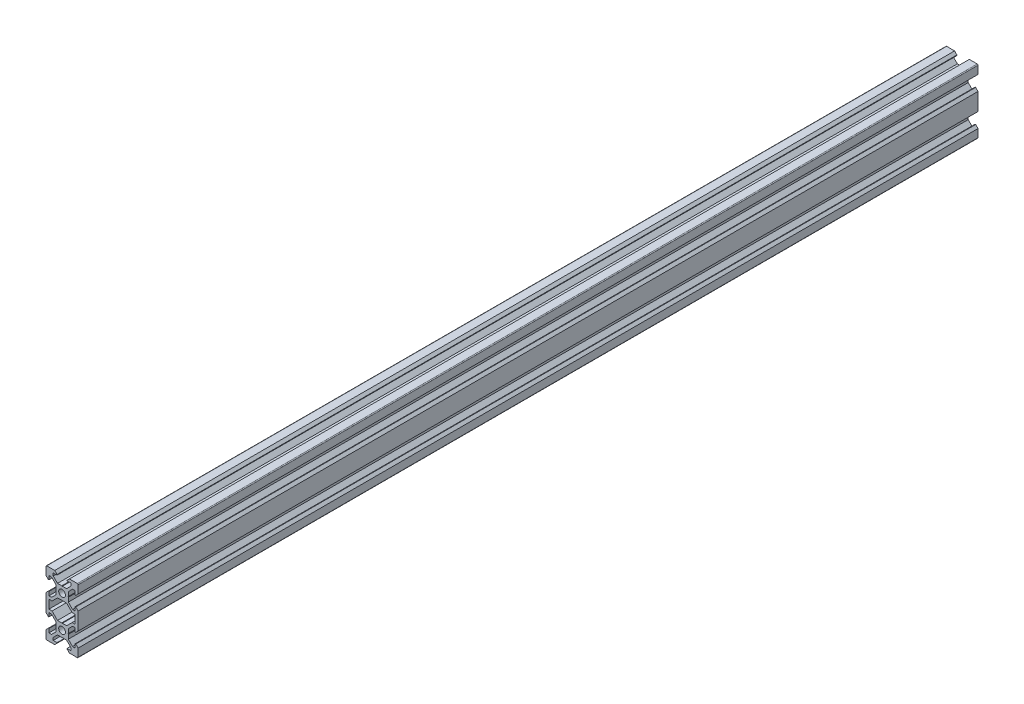
from build123d import *
from build123d.topology import SkipClean

# Parameters (mm, degrees)
BOSS_EXTRU_1_DEPTH     = 560.3
SYM_TRIE6_COPY_1_DEPTH = 560.3


with BuildPart() as part:
    # Esquisse1 → Boss.-Extru.1 (new body)
    with BuildSketch(Plane.XY):
        with BuildLine():
            Line((-9.5, 10), (-4.58, 10))
            Line((-4.58, 10), (-3.125, 8.545))
            Line((-3.125, 8.545), (-3.125, 8.2))
            Line((-3.125, 8.2), (-5.5, 8.2))
            Line((-5.5, 8.2), (-5.5, 6.560660172))
            Line((-5.5, 6.560660172), (-2.839339828, 3.9))
            Line((-2.839339828, 3.9), (-0.21, 3.9))
            Line((-0.21, 3.9), (0, 3.69))
            Line((0, 3.69), (0, 2.1))
            ThreePointArc((0, 2.1), (-2.1, 0), (0, -2.1))
            Line((0, -2.1), (0, -3.69))
            Line((0, -3.69), (-0.21, -3.9))
            Line((-0.21, -3.9), (-2.839339828, -3.9))
            Line((-2.839339828, -3.9), (-6.239339828, -7.3))
            Line((-6.239339828, -7.3), (-8.2, -7.3))
            Line((-8.2, -7.3), (-8.2, -10))
            Line((-8.2, -10), (-10, -10))
            Line((-10, -10), (-10, -4.58))
            Line((-10, -4.58), (-8.545, -3.125))
            Line((-8.545, -3.125), (-8.2, -3.125))
            Line((-8.2, -3.125), (-8.2, -5.5))
            Line((-8.2, -5.5), (-6.560660172, -5.5))
            Line((-6.560660172, -5.5), (-3.9, -2.839339828))
            Line((-3.9, -2.839339828), (-3.9, -0.21))
            Line((-3.9, -0.21), (-3.69, 0))
            Line((-3.69, 0), (-3.9, 0.21))
            Line((-3.9, 0.21), (-3.9, 2.839339828))
            Line((-3.9, 2.839339828), (-6.560660172, 5.5))
            Line((-6.560660172, 5.5), (-8.2, 5.5))
            Line((-8.2, 5.5), (-8.2, 3.125))
            Line((-8.2, 3.125), (-8.545, 3.125))
            Line((-8.545, 3.125), (-10, 4.58))
            Line((-10, 4.58), (-10, 9.5))
            ThreePointArc((-10, 9.5), (-9.853553391, 9.853553391), (-9.5, 10))
        make_face()
    boss_extru_1 = extrude(amount=BOSS_EXTRU_1_DEPTH)

    # Symétrie1: Boss.-Extru.1 across plane
    add(boss_extru_1.mirror(Plane(origin=(0, 3.69, 560.3), x_dir=(0, 0, 1), z_dir=(-1, 0, 0))))

    # Symétrie6: Boss.-Extru.1 across plane
    add(boss_extru_1.mirror(Plane(origin=(-8.2, -10, 560.3), x_dir=(0, 0, 1), z_dir=(0, 1, 0))))

    # Symétrie6 copy 1 sketch → Symétrie6 copy 1 (add)
    with SkipClean():  # the faces are left unmerged after this step: merging them gives an invalid solid
        with BuildSketch(Plane(origin=(0, -20, 0), x_dir=(-1, 0, 0), z_dir=(0, 0, 1))):
            with BuildLine():
                Line((-9.5, 10), (-4.58, 10))
                Line((-4.58, 10), (-3.125, 8.545))
                Line((-3.125, 8.545), (-3.125, 8.2))
                Line((-3.125, 8.2), (-5.5, 8.2))
                Line((-5.5, 8.2), (-5.5, 6.560660172))
                Line((-5.5, 6.560660172), (-2.839339828, 3.9))
                Line((-2.839339828, 3.9), (-0.21, 3.9))
                Line((-0.21, 3.9), (0, 3.69))
                Line((0, 3.69), (0, 2.1))
                ThreePointArc((0, 2.1), (-2.1, 0), (0, -2.1))
                Line((0, -2.1), (0, -3.69))
                Line((0, -3.69), (-0.21, -3.9))
                Line((-0.21, -3.9), (-2.839339828, -3.9))
                Line((-2.839339828, -3.9), (-6.239339828, -7.3))
                Line((-6.239339828, -7.3), (-8.2, -7.3))
                Line((-8.2, -7.3), (-8.2, -10))
                Line((-8.2, -10), (-10, -10))
                Line((-10, -10), (-10, -4.58))
                Line((-10, -4.58), (-8.545, -3.125))
                Line((-8.545, -3.125), (-8.2, -3.125))
                Line((-8.2, -3.125), (-8.2, -5.5))
                Line((-8.2, -5.5), (-6.560660172, -5.5))
                Line((-6.560660172, -5.5), (-3.9, -2.839339828))
                Line((-3.9, -2.839339828), (-3.9, -0.21))
                Line((-3.9, -0.21), (-3.69, 0))
                Line((-3.69, 0), (-3.9, 0.21))
                Line((-3.9, 0.21), (-3.9, 2.839339828))
                Line((-3.9, 2.839339828), (-6.560660172, 5.5))
                Line((-6.560660172, 5.5), (-8.2, 5.5))
                Line((-8.2, 5.5), (-8.2, 3.125))
                Line((-8.2, 3.125), (-8.545, 3.125))
                Line((-8.545, 3.125), (-10, 4.58))
                Line((-10, 4.58), (-10, 9.5))
                ThreePointArc((-10, 9.5), (-9.853553391, 9.853553391), (-9.5, 10))
            make_face()
        extrude(amount=SYM_TRIE6_COPY_1_DEPTH)


solid = part.part
